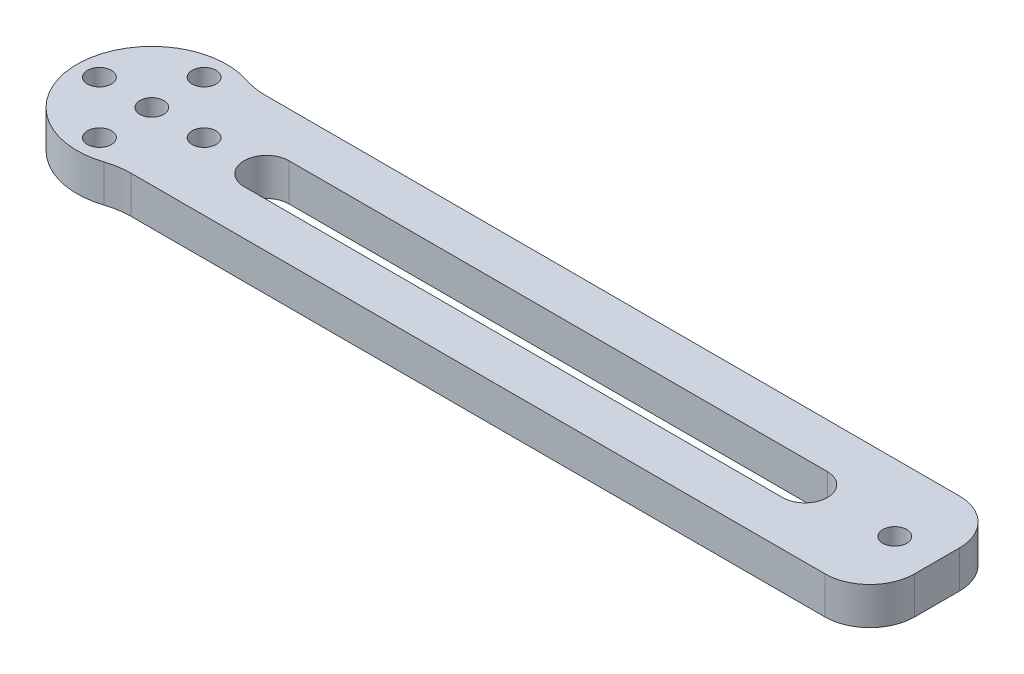
from build123d import *

# Parameters (mm, degrees)
SKETCH_1_R          = 1.6
SKETCH_1_R_2        = 9
EXTRUDE_1_DEPTH     = 5
SKETCH_2_R          = 4.2
CUT_EXTRUDE_1_DEPTH = 2.5
EXTRUDE_START       = -5
SKETCH_3_R          = 10
SKETCH_3_R_2        = 9
EXTRUDE_2_DEPTH     = 5
FILLET_1_R          = 10


with BuildPart() as part:
    # 草图1 → 凸台-拉伸1 (new body)
    # profile 1 of 2: a face of its own
    with BuildSketch(Plane(origin=(0, 0, 0), x_dir=(1, 0, 0), z_dir=(0, 1, 0))):
        with BuildLine():
            Line((99, 9), (0, 9))
            ThreePointArc((0, 9), (6.363961031, 6.363961031), (9, 0))
            ThreePointArc((9, 0), (6.363961031, -6.363961031), (0, -9))
            Line((0, -9), (99, -9))
            ThreePointArc((99, -9), (103.242640687, -7.242640687), (105, -3))
            Line((105, -3), (105, 3))
            ThreePointArc((105, 3), (103.242640687, 7.242640687), (99, 9))
        make_face()
        with BuildLine():
            ThreePointArc((15.34, -3), (12.34, 0), (15.34, 3))
            Line((15.34, 3), (87.34, 3))
            ThreePointArc((87.34, 3), (90.34, 0), (87.34, -3))
            Line((87.34, -3), (15.34, -3))
        make_face(mode=Mode.SUBTRACT)
        with Locations(Location((99.34, 0, 0), (0, 0, 270))):
            Circle(SKETCH_1_R, mode=Mode.SUBTRACT)
    # profile 2 of 2: a face of its own
    with BuildSketch(Plane(origin=(0, 0, 0), x_dir=(1, 0, 0), z_dir=(0, 1, 0))):
        Circle(SKETCH_1_R_2)
        with Locations(Location((0, -7, 0), (0, 0, 270))):
            Circle(SKETCH_1_R, mode=Mode.SUBTRACT)
        with Locations(Location((7, 0, 0), (0, 0, 270))):
            Circle(SKETCH_1_R, mode=Mode.SUBTRACT)
        with Locations(Location((0, 7, 0), (0, 0, 270))):
            Circle(SKETCH_1_R, mode=Mode.SUBTRACT)
        with Locations(Location((-7, 0, 0), (0, 0, 270))):
            Circle(SKETCH_1_R, mode=Mode.SUBTRACT)
        with Locations(Location((0, 0, 0), (0, 0, 270))):
            Circle(SKETCH_1_R, mode=Mode.SUBTRACT)
    extrude(amount=EXTRUDE_1_DEPTH)

    # 草图2 → 切除-拉伸1 (cut)
    with BuildSketch(Plane.XZ):
        with Locations(Location((99.34, 0, 0), (0, 0, 270))):
            Circle(SKETCH_2_R)
    extrude(amount=-CUT_EXTRUDE_1_DEPTH, mode=Mode.SUBTRACT)

    # 草图3 → 凸台-拉伸2 (add)
    with BuildSketch(Plane(origin=(0, 5, 0), x_dir=(1, 0, 0), z_dir=(0, 1, 0)).offset(EXTRUDE_START)):
        Circle(SKETCH_3_R)
        Circle(SKETCH_3_R_2, mode=Mode.SUBTRACT)
    extrude(amount=EXTRUDE_2_DEPTH)

    # 圆角1
    fillet_1_edges = [part.edges().sort_by_distance(p)[0] for p in [
        (4.358898944, 2.5, -9),
        (4.358898944, 2.5, 9),
    ]]
    fillet(fillet_1_edges, radius=FILLET_1_R)


solid = part.part
